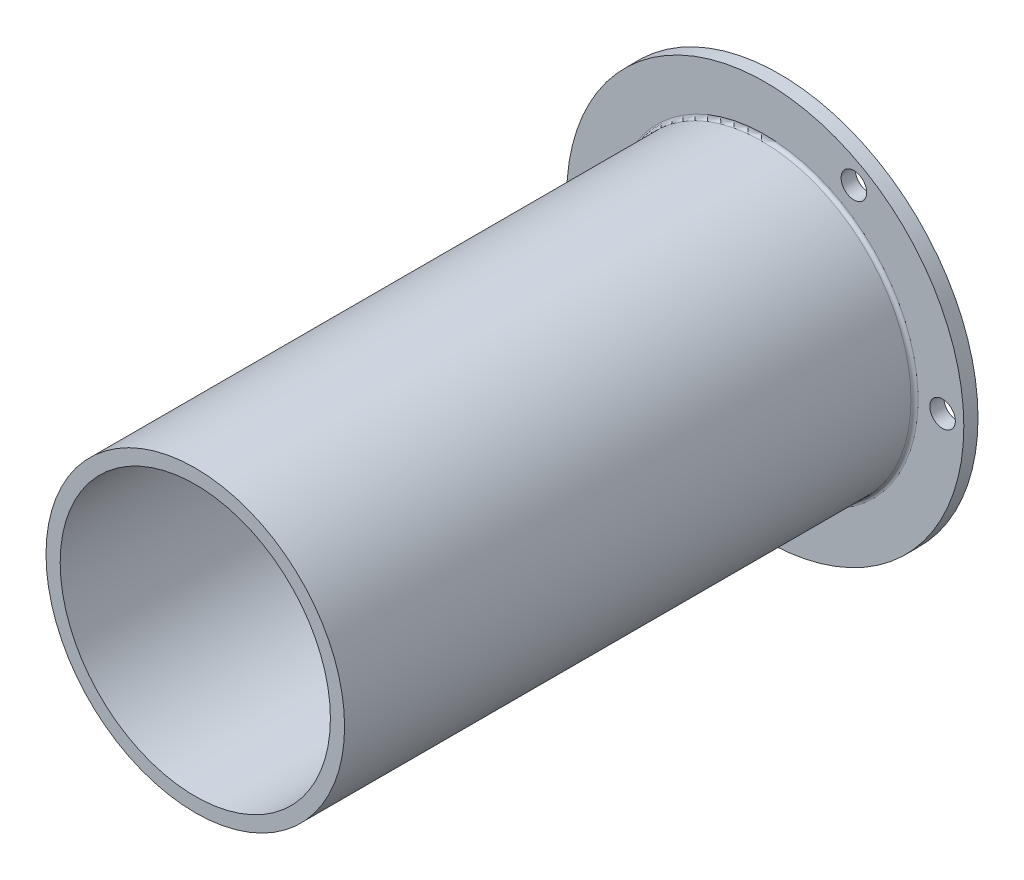
from build123d import *
from build123d.topology import SkipClean

# Parameters (mm, degrees)
SKETCH1_R           = 10.525
SKETCH1_R_2         = 9.525
BOSS_EXTRUDE1_DEPTH = 40.18
BOSS_EXTRUDE2_START = 1
SKETCH2_R           = 14
SKETCH2_R_2         = 9.525
BOSS_EXTRUDE2_DEPTH = 1
CIRPATTERN1_COUNT   = 6
FILLET1_R           = 0.25


with BuildPart() as part:
    # Sketch1 → Boss-Extrude1 (new body)
    with BuildSketch(Plane.XY):
        Circle(SKETCH1_R)
        Circle(SKETCH1_R_2, mode=Mode.SUBTRACT)
    extrude(amount=BOSS_EXTRUDE1_DEPTH)

    # Sketch2 → Boss-Extrude2 (add)
    with SkipClean():  # the faces are left unmerged after this step: merging them gives an invalid solid
        with BuildSketch(Plane(origin=(0, 0, 0), x_dir=(-1, 0, 0), z_dir=(0, 0, -1)).offset(BOSS_EXTRUDE2_START)):
            Circle(SKETCH2_R)
            Circle(SKETCH2_R_2, mode=Mode.SUBTRACT)
        extrude(amount=-BOSS_EXTRUDE2_DEPTH)

    # Sketch11 → M1.6 Clearance Hole1 (revolve, cut)
    with SkipClean():  # the faces are left unmerged after this step: merging them gives an invalid solid
        with BuildSketch(Plane(origin=(-12.5, 0, 0), x_dir=(0, -1, 0), z_dir=(1, 0, 0))):
            Polygon((0, 0), (0, 5.540774557), (0.9, 5), (0.9, 0), align=None)
        m1_6_clearance_hole1 = revolve(axis=Axis((-12.5, 0, 6.35), (0, 0, -1)), mode=Mode.SUBTRACT)

    # CirPattern1: M1.6 Clearance Hole1 ×6 about axis, 2 skipped
    with SkipClean():  # the faces are left unmerged after this step: merging them gives an invalid solid
        cirpattern1_axis = Axis((0, 0, 0), (0, 0, -1))
        add([m1_6_clearance_hole1.rotate(cirpattern1_axis, i * 360 / CIRPATTERN1_COUNT) for i in range(1, CIRPATTERN1_COUNT) if i not in (1, 4)], mode=Mode.SUBTRACT)

    # Fillet1
    fillet1_edges = [part.edges().sort_by_distance(p)[0] for p in [
        (-10.525, 0, 0),
    ]]
    fillet(fillet1_edges, radius=FILLET1_R)


solid = part.part
